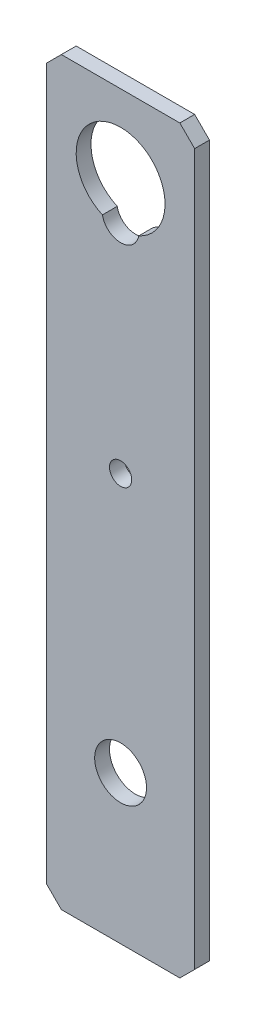
from build123d import *

# Parameters (mm, degrees)
SKETCH1_W           = 20
SKETCH1_H           = 100
BOSS_EXTRUDE1_DEPTH = 2
CUT_EXTRUDE1_REACH  = 53.029
SKETCH2_R           = 1.5
SKETCH2_R_2         = 3.5
CHAMFER1_SIZE       = 2


with BuildPart() as part:
    # Sketch1 → Boss-Extrude1 (new body)
    with BuildSketch(Plane.XY):
        Rectangle(SKETCH1_W, SKETCH1_H)
    extrude(amount=BOSS_EXTRUDE1_DEPTH)

    # Sketch2 → Cut-Extrude1 (cut, up to next)
    with BuildSketch(Plane.XY.offset(2), mode=Mode.PRIVATE) as cut_extrude1_sk1:
        with Locations((0, 5)):
            Circle(SKETCH2_R)
    cut_extrude1_tool1 = extrude(cut_extrude1_sk1.sketch, amount=-CUT_EXTRUDE1_REACH, mode=Mode.PRIVATE) & part.part
    # Sketch2 → Cut-Extrude1 (cut, up to next)
    with BuildSketch(Plane.XY.offset(2), mode=Mode.PRIVATE) as cut_extrude1_sk2:
        with Locations((0, -30)):
            Circle(SKETCH2_R_2)
    cut_extrude1_tool2 = extrude(cut_extrude1_sk2.sketch, amount=-CUT_EXTRUDE1_REACH, mode=Mode.PRIVATE) & part.part
    # Sketch2 → Cut-Extrude1 (cut, up to next)
    with BuildSketch(Plane.XY.offset(2), mode=Mode.PRIVATE) as cut_extrude1_sk3:
        with BuildLine():
            ThreePointArc((2.454460226, 34.025), (0, 45.5), (-2.454460226, 34.025))
            ThreePointArc((-2.454460226, 34.025), (0, 32), (2.454460226, 34.025))
        make_face()
    cut_extrude1_tool3 = extrude(cut_extrude1_sk3.sketch, amount=-CUT_EXTRUDE1_REACH, mode=Mode.PRIVATE) & part.part
    add(cut_extrude1_tool1.solids().sort_by_distance((0, 5, 2))[0], mode=Mode.SUBTRACT)
    add(cut_extrude1_tool2.solids().sort_by_distance((0, -30, 2))[0], mode=Mode.SUBTRACT)
    add(cut_extrude1_tool3.solids().sort_by_distance((0, 39.186214, 2))[0], mode=Mode.SUBTRACT)

    # Chamfer1
    chamfer1_edges = [part.edges().sort_by_distance(p)[0] for p in [
        (10, -50, 1),
        (-10, -50, 1),
        (-10, 50, 1),
        (10, 50, 1),
    ]]
    chamfer(chamfer1_edges, length=CHAMFER1_SIZE)


solid = part.part
